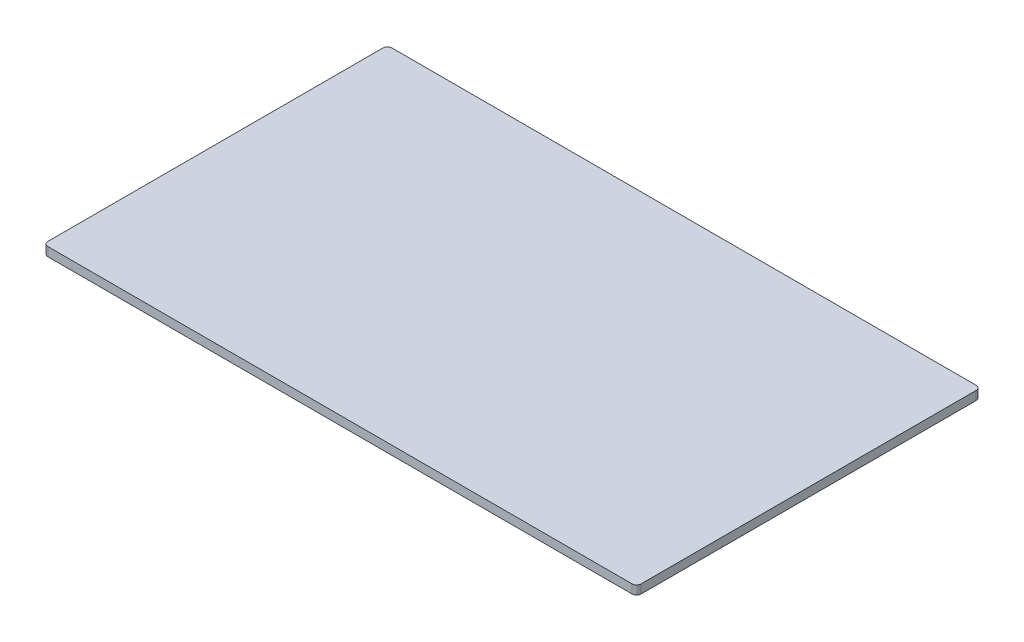
from build123d import *

# Parameters (mm, degrees)
SKETCH1_W           = 67.25
SKETCH1_H           = 39
BOSS_EXTRUDE1_DEPTH = 1
FILLET1_R           = 0.5


with BuildPart() as part:
    # Sketch1 → Boss-Extrude1 (new body)
    with BuildSketch(Plane(origin=(0, 0, 0), x_dir=(1, 0, 0), z_dir=(0, 1, 0))):
        with Locations((33.625, 19.5)):
            Rectangle(SKETCH1_W, SKETCH1_H)
    extrude(amount=BOSS_EXTRUDE1_DEPTH)

    # Fillet1
    fillet1_edges = [part.edges().sort_by_distance(p)[0] for p in [
        (0, 0.5, -39),
        (67.25, 0.5, -39),
        (67.25, 0.5, 0),
        (0, 0.5, 0),
    ]]
    fillet(fillet1_edges, radius=FILLET1_R)


solid = part.part
